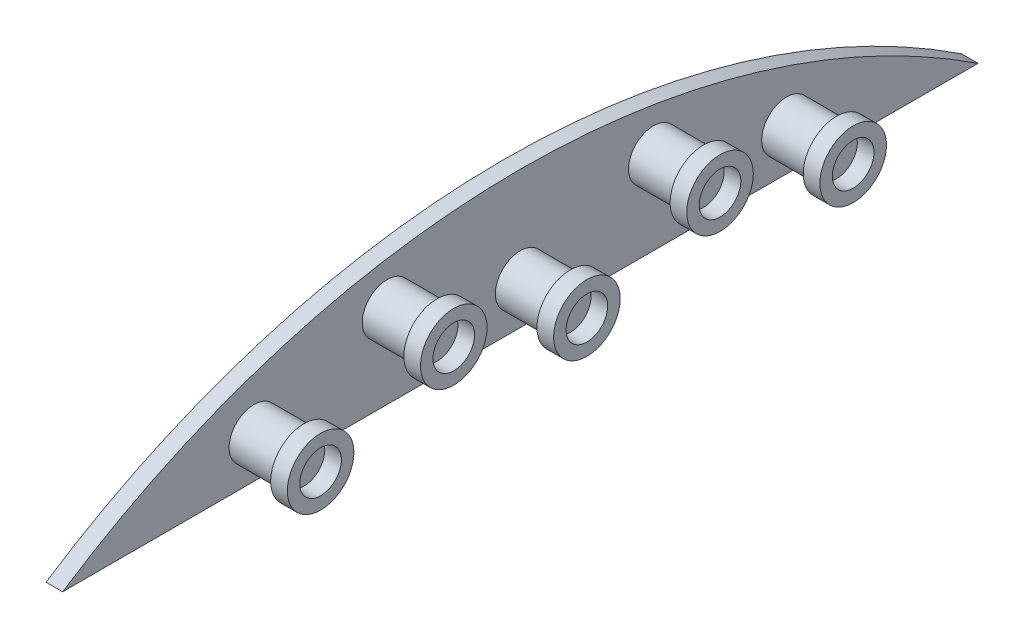
from build123d import *

# Parameters (mm, degrees)
EXTRUDE_1_DEPTH = 2
SKETCH_2_R      = 3
EXTRUDE_2_DEPTH = 6
SKETCH_3_R      = 4
SKETCH_3_R_2    = 2.5
EXTRUDE_3_DEPTH = 2


with BuildPart() as part:
    # ｽｹｯﾁ1 → 押し出し1 (new body)
    with BuildSketch(Plane(origin=(0, 0, 0), x_dir=(0, 0, -1), z_dir=(1, 0, 0))):
        with BuildLine():
            ThreePointArc((55, 16.483534558), (26.291521673, 12.27405221), (0, 0))
            Line((0, 0), (55, 0))
            Line((55, 0), (55, 16.483534558))
        make_face()
        with BuildLine():
            Line((55, 16.483534558), (55, 0))
            Line((55, 0), (110, 0))
            ThreePointArc((110, 0), (83.708478327, 12.27405221), (55, 16.483534558))
        make_face()
    extrude(amount=EXTRUDE_1_DEPTH)

    # ｽｹｯﾁ2 → 押し出し2 (add)
    with BuildSketch(Plane(origin=(2, 0, 0), x_dir=(0, 0, -1), z_dir=(1, 0, 0))):
        with Locations((23, 5)):
            Circle(SKETCH_2_R)
        with Locations((39, 10)):
            Circle(SKETCH_2_R)
        with Locations((55, 5)):
            Circle(SKETCH_2_R)
        with Locations((71, 10)):
            Circle(SKETCH_2_R)
        with Locations((87, 5)):
            Circle(SKETCH_2_R)
    extrude(amount=EXTRUDE_2_DEPTH)

    # ｽｹｯﾁ3 → 押し出し3 (add)
    # profile 1 of 5: a face of its own
    with BuildSketch(Plane(origin=(8, 0, 0), x_dir=(0, 0, -1), z_dir=(1, 0, 0))):
        with Locations((23, 5)):
            Circle(SKETCH_3_R)
        with Locations((23, 5)):
            Circle(SKETCH_3_R_2, mode=Mode.SUBTRACT)
    # profile 2 of 5: a face of its own
    with BuildSketch(Plane(origin=(8, 0, 0), x_dir=(0, 0, -1), z_dir=(1, 0, 0))):
        with Locations((39, 10)):
            Circle(SKETCH_3_R)
        with Locations((39, 10)):
            Circle(SKETCH_3_R_2, mode=Mode.SUBTRACT)
    # profile 3 of 5: a face of its own
    with BuildSketch(Plane(origin=(8, 0, 0), x_dir=(0, 0, -1), z_dir=(1, 0, 0))):
        with Locations((55, 5)):
            Circle(SKETCH_3_R)
        with Locations((55, 5)):
            Circle(SKETCH_3_R_2, mode=Mode.SUBTRACT)
    # profile 4 of 5: a face of its own
    with BuildSketch(Plane(origin=(8, 0, 0), x_dir=(0, 0, -1), z_dir=(1, 0, 0))):
        with Locations((71, 10)):
            Circle(SKETCH_3_R)
        with Locations((71, 10)):
            Circle(SKETCH_3_R_2, mode=Mode.SUBTRACT)
    # profile 5 of 5: a face of its own
    with BuildSketch(Plane(origin=(8, 0, 0), x_dir=(0, 0, -1), z_dir=(1, 0, 0))):
        with Locations((87, 5)):
            Circle(SKETCH_3_R)
        with Locations((87, 5)):
            Circle(SKETCH_3_R_2, mode=Mode.SUBTRACT)
    extrude(amount=EXTRUDE_3_DEPTH)


solid = part.part
